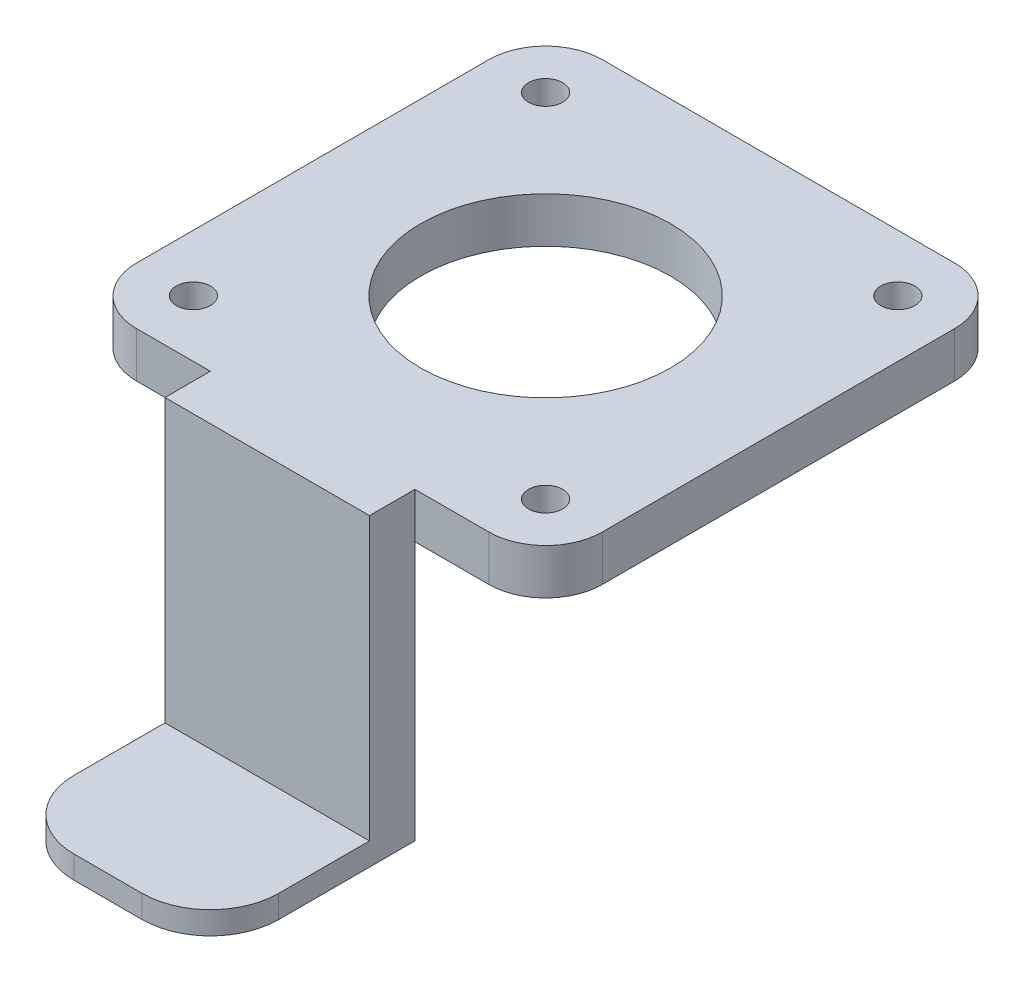
from build123d import *

# Parameters (mm, degrees)
SKETCH_2_R        = 11
SKETCH_2_R_2      = 1.5
EXTRUDE_483_DEPTH = 4
SKETCH_3_W        = 18
SKETCH_3_H        = 26.8
EXTRUDE_726_DEPTH = 4
EXTRUDE_922_DEPTH = 2


with BuildPart() as part:
    # Эскиз2 → Extrude 483 (new body)
    with BuildSketch(Plane(origin=(0, 0, 0), x_dir=(1, 0, 0), z_dir=(0, 1, 0))):
        with BuildLine():
            Line((-15.5, -20.5), (15.5, -20.5))
            ThreePointArc((15.5, -20.5), (19.035533906, -19.035533906), (20.5, -15.5))
            Line((20.5, -15.5), (20.5, 15.5))
            ThreePointArc((20.5, 15.5), (19.035533906, 19.035533906), (15.5, 20.5))
            Line((15.5, 20.5), (-15.5, 20.5))
            ThreePointArc((-15.5, 20.5), (-19.035533906, 19.035533906), (-20.5, 15.5))
            Line((-20.5, 15.5), (-20.5, -15.5))
            ThreePointArc((-20.5, -15.5), (-19.035533906, -19.035533906), (-15.5, -20.5))
        make_face()
        with Locations(Location((0, 0, 0), (0, 0, 270))):
            Circle(SKETCH_2_R, mode=Mode.SUBTRACT)
        with Locations(Location((-15.5, 15.5, 0), (0, 0, 270))):
            Circle(SKETCH_2_R_2, mode=Mode.SUBTRACT)
        with Locations(Location((15.5, -15.5, 0), (0, 0, 90))):
            Circle(SKETCH_2_R_2, mode=Mode.SUBTRACT)
        with Locations(Location((-15.5, -15.5, 0), (0, 0, 90))):
            Circle(SKETCH_2_R_2, mode=Mode.SUBTRACT)
        with Locations(Location((15.5, 15.5, 0), (0, 0, 270))):
            Circle(SKETCH_2_R_2, mode=Mode.SUBTRACT)
    extrude(amount=EXTRUDE_483_DEPTH)

    # Эскиз3 → Extrude 726 (add)
    with BuildSketch(Plane.XY.offset(20.5)):
        with Locations((0, -9.4)):
            Rectangle(SKETCH_3_W, SKETCH_3_H)
    extrude(amount=EXTRUDE_726_DEPTH)

    # Эскиз4 → Extrude 922 (add)
    with BuildSketch(Plane.XZ.offset(22.8)):
        with BuildLine():
            Line((9, 24.5), (-9, 24.5))
            Line((-9, 24.5), (-9, 32.5))
            ThreePointArc((-9, 32.5), (-7.242640687, 36.742640687), (-3, 38.5))
            Line((-3, 38.5), (3, 38.5))
            ThreePointArc((3, 38.5), (7.242640687, 36.742640687), (9, 32.5))
            Line((9, 32.5), (9, 24.5))
        make_face()
    extrude(amount=-EXTRUDE_922_DEPTH)


solid = part.part
